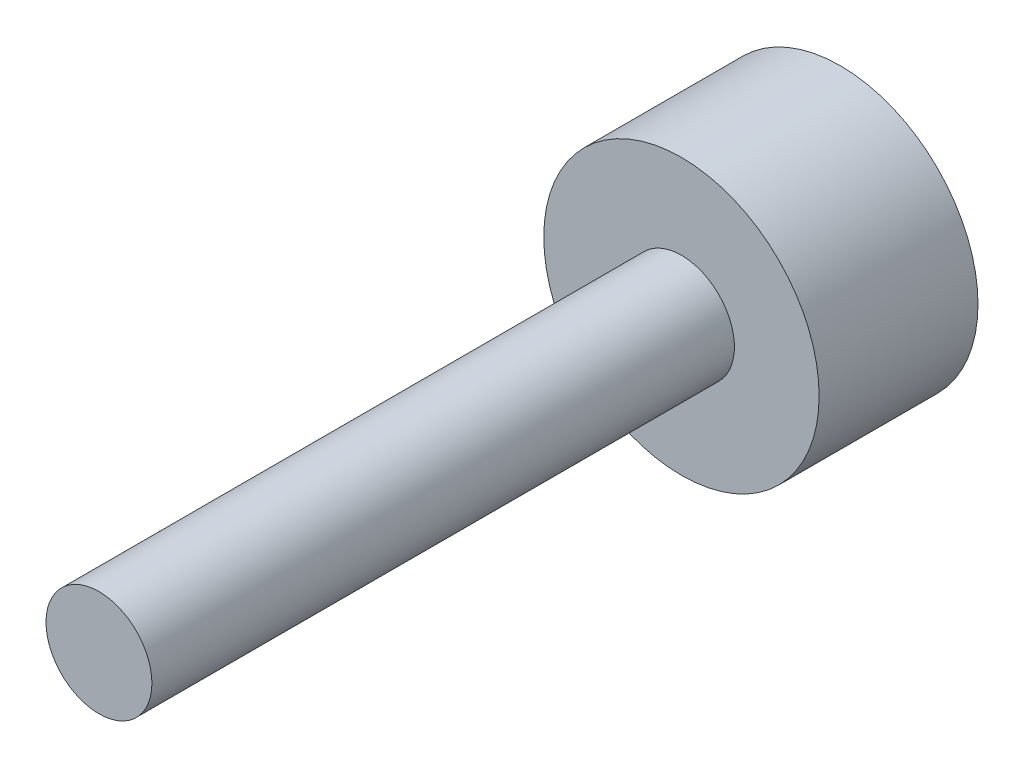
from build123d import *

# Parameters (mm, degrees)
SKETCH1_R           = 5
BOSS_EXTRUDE1_DEPTH = 60
SKETCH2_R           = 13
BOSS_EXTRUDE2_DEPTH = 15
SKETCH3_R           = 5
CUT_EXTRUDE2_DEPTH  = 10


with BuildPart() as part:
    # Sketch1 → Boss-Extrude1 (new body)
    with BuildSketch(Plane.XY):
        Circle(SKETCH1_R)
    extrude(amount=BOSS_EXTRUDE1_DEPTH)

    # Sketch2 → Boss-Extrude2 (add)
    with BuildSketch(Plane(origin=(0, 0, 5), x_dir=(-1, 0, 0), z_dir=(0, 0, -1))):
        Circle(SKETCH2_R)
    extrude(amount=BOSS_EXTRUDE2_DEPTH)

    # Sketch3 → Cut-Extrude2 (cut)
    with BuildSketch(Plane(origin=(0, 0, -10), x_dir=(-1, 0, 0), z_dir=(0, 0, -1))):
        Circle(SKETCH3_R)
    extrude(amount=-CUT_EXTRUDE2_DEPTH, mode=Mode.SUBTRACT)


solid = part.part
